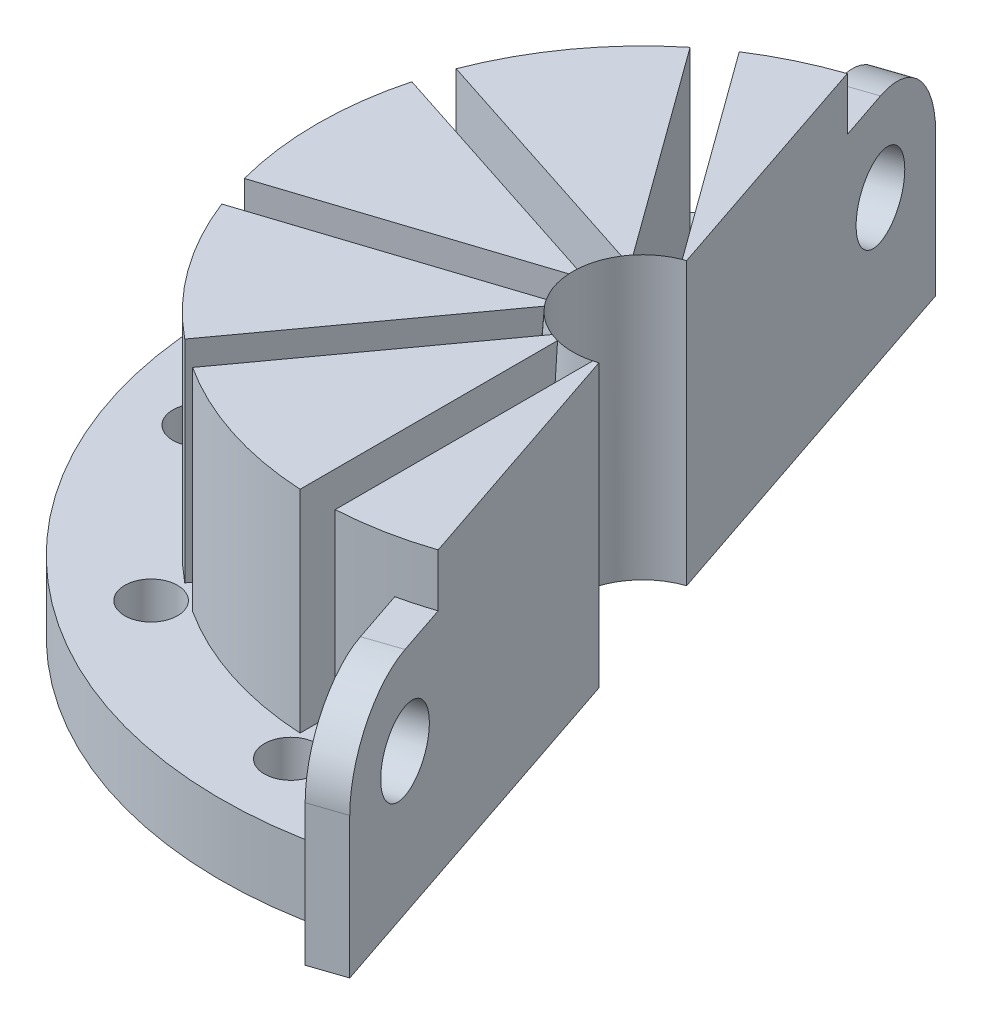
from build123d import *
from build123d.topology import SkipClean

# Parameters (mm, degrees)
SKETCH1_R           = 11.984375
SKETCH1_R_2         = 1.984375
SKETCH1_R_3         = 0.75
BOSS_EXTRUDE1_DEPTH = 2
SKETCH6_W           = 23.96875
SKETCH6_H           = 8
CUT_EXTRUDE1_DEPTH  = 19.741677841
BOSS_EXTRUDE3_START = -2
SKETCH7_R           = 1.65
BOSS_EXTRUDE3_DEPTH = 2
SKETCH8_R           = 1.1
BOSS_EXTRUDE4_DEPTH = 1
CUT_EXTRUDE2_DEPTH  = 23.122053344


with BuildPart() as part:
    # Sketch1 → Boss-Extrude1 (new body)
    with BuildSketch(Plane(origin=(0, 0, 0), x_dir=(1, 0, 0), z_dir=(0, 1, 0))):
        with Locations(Location((0, 0, 0), (0, 0, 270))):
            Circle(SKETCH1_R)
        with Locations(Location((0, 0, 0), (0, 0, 270))):
            Circle(SKETCH1_R_2, mode=Mode.SUBTRACT)
        with Locations(Location((0, 10, 0), (0, 0, 270))):
            Circle(SKETCH1_R_3, mode=Mode.SUBTRACT)
        with Locations(Location((5.877852523, 8.090169944, 0), (0, 0, 270))):
            Circle(SKETCH1_R_3, mode=Mode.SUBTRACT)
        with Locations(Location((9.510565163, 3.090169944, 0), (0, 0, 270))):
            Circle(SKETCH1_R_3, mode=Mode.SUBTRACT)
        with Locations(Location((9.510565163, -3.090169944, 0), (0, 0, 270))):
            Circle(SKETCH1_R_3, mode=Mode.SUBTRACT)
        with Locations(Location((5.877852523, -8.090169944, 0), (0, 0, 270))):
            Circle(SKETCH1_R_3, mode=Mode.SUBTRACT)
        with Locations(Location((0, -10, 0), (0, 0, 270))):
            Circle(SKETCH1_R_3, mode=Mode.SUBTRACT)
        with Locations(Location((-5.877852523, -8.090169944, 0), (0, 0, 270))):
            Circle(SKETCH1_R_3, mode=Mode.SUBTRACT)
        with Locations(Location((-9.510565163, -3.090169944, 0), (0, 0, 270))):
            Circle(SKETCH1_R_3, mode=Mode.SUBTRACT)
        with Locations(Location((-9.510565163, 3.090169944, 0), (0, 0, 270))):
            Circle(SKETCH1_R_3, mode=Mode.SUBTRACT)
        with Locations(Location((-5.877852523, 8.090169944, 0), (0, 0, 270))):
            Circle(SKETCH1_R_3, mode=Mode.SUBTRACT)
    extrude(amount=BOSS_EXTRUDE1_DEPTH)

    # Sweep1: sweep along a path in Sketch3
    with SkipClean():  # the faces are left unmerged after this step: merging them gives an invalid solid
        with BuildLine(Plane(origin=(0, 0, 0), x_dir=(0, 0, -1), z_dir=(1, 0, 0))) as sweep1_path:
            Line((0, 2), (0, 8))
        # Sketch2 → Sweep1 (sweep)
        with BuildSketch(Plane(origin=(0, 2, 0), x_dir=(1, 0, 0), z_dir=(0, 1, 0))):
            with BuildLine():
                Line((-0.5, 9.236476601), (-0.5, 1.920350005))
                ThreePointArc((-0.5, 1.920350005), (-0.613205598, 1.887252775), (-0.724244915, 1.847488415))
                Line((-0.724244915, 1.847488415), (-5.024556232, 7.766359164))
                ThreePointArc((-5.024556232, 7.766359164), (-2.858407198, 8.797272776), (-0.5, 9.236476601))
            make_face()
            with BuildLine():
                Line((0.5, 9.236476601), (0.5, 1.920350005))
                ThreePointArc((0.5, 1.920350005), (0.613205598, 1.887252775), (0.724244915, 1.847488415))
                Line((0.724244915, 1.847488415), (5.024556232, 7.766359164))
                ThreePointArc((5.024556232, 7.766359164), (2.858407198, 8.797272776), (0.5, 9.236476601))
            make_face()
            with BuildLine():
                Line((5.833573226, 7.178573912), (1.533261909, 1.259703163))
                ThreePointArc((1.533261909, 1.259703163), (1.605393098, 1.16638636), (1.671852888, 1.068949045))
                Line((1.671852888, 1.068949045), (8.629902762, 3.329756496))
                ThreePointArc((8.629902762, 3.329756496), (7.483407198, 5.437013584), (5.833573226, 7.178573912))
            make_face()
            with BuildLine():
                Line((8.938919756, 2.37869998), (1.980869883, 0.117892528))
                ThreePointArc((1.980869883, 0.117892528), (1.984375, 0), (1.980869883, -0.117892528))
                Line((1.980869883, -0.117892528), (8.938919756, -2.37869998))
                ThreePointArc((8.938919756, -2.37869998), (9.25, 0), (8.938919756, 2.37869998))
            make_face()
            with BuildLine():
                Line((8.629902762, -3.329756496), (1.671852888, -1.068949045))
                ThreePointArc((1.671852888, -1.068949045), (1.605393098, -1.16638636), (1.533261909, -1.259703163))
                Line((1.533261909, -1.259703163), (5.833573226, -7.178573912))
                ThreePointArc((5.833573226, -7.178573912), (7.483407198, -5.437013584), (8.629902762, -3.329756496))
            make_face()
            with BuildLine():
                Line((5.024556232, -7.766359164), (0.724244915, -1.847488415))
                ThreePointArc((0.724244915, -1.847488415), (0.613205598, -1.887252775), (0.5, -1.920350005))
                Line((0.5, -1.920350005), (0.5, -9.236476601))
                ThreePointArc((0.5, -9.236476601), (2.858407198, -8.797272776), (5.024556232, -7.766359164))
            make_face()
            with BuildLine():
                Line((-0.5, -9.236476601), (-0.5, -1.920350005))
                ThreePointArc((-0.5, -1.920350005), (-0.613205598, -1.887252775), (-0.724244915, -1.847488415))
                Line((-0.724244915, -1.847488415), (-5.024556232, -7.766359164))
                ThreePointArc((-5.024556232, -7.766359164), (-2.858407198, -8.797272776), (-0.5, -9.236476601))
            make_face()
            with BuildLine():
                Line((-5.833573226, -7.178573912), (-1.533261909, -1.259703163))
                ThreePointArc((-1.533261909, -1.259703163), (-1.605393098, -1.16638636), (-1.671852888, -1.068949045))
                Line((-1.671852888, -1.068949045), (-8.629902762, -3.329756496))
                ThreePointArc((-8.629902762, -3.329756496), (-7.483407198, -5.437013584), (-5.833573226, -7.178573912))
            make_face()
            with BuildLine():
                Line((-8.938919756, -2.37869998), (-1.980869883, -0.117892528))
                ThreePointArc((-1.980869883, -0.117892528), (-1.984375, 0), (-1.980869883, 0.117892528))
                Line((-1.980869883, 0.117892528), (-8.938919756, 2.37869998))
                ThreePointArc((-8.938919756, 2.37869998), (-9.25, 0), (-8.938919756, -2.37869998))
            make_face()
            with BuildLine():
                Line((-8.629902762, 3.329756496), (-1.671852888, 1.068949045))
                ThreePointArc((-1.671852888, 1.068949045), (-1.605393098, 1.16638636), (-1.533261909, 1.259703163))
                Line((-1.533261909, 1.259703163), (-5.833573226, 7.178573912))
                ThreePointArc((-5.833573226, 7.178573912), (-7.483407198, 5.437013584), (-8.629902762, 3.329756496))
            make_face()
        sweep(path=sweep1_path.line)

    # Sketch4 → Revolve1 (revolve)
    with SkipClean():  # the faces are left unmerged after this step: merging them gives an invalid solid
        with BuildSketch(Plane(origin=(0, 0, 0), x_dir=(0, 0, -1), z_dir=(1, 0, 0)), mode=Mode.PRIVATE) as revolve1_sk:
            Polygon((-2.37869998, 2), (-1.984375, 2), (-1.984375, 8), align=None)
        revolve(revolve1_sk.sketch.rotate(Axis((0, 0, 0), (0, 1, 0)), 165.405971265), axis=Axis((0, 0, 0), (0, 1, 0)))

    # Sketch6 → Cut-Extrude1 (cut, through all)
    with SkipClean():  # the faces are left unmerged after this step: merging them gives an invalid solid
        with BuildSketch(Plane(origin=(0, 0, 0), x_dir=(-0.3193728209047868, 0, -0.9476291475399641), z_dir=(-0.9476291475399641, 0, 0.3193728209047868))):
            with Locations((0, -4)):
                Rectangle(SKETCH6_W, SKETCH6_H)
        extrude(amount=-CUT_EXTRUDE1_DEPTH, mode=Mode.SUBTRACT)

    # Sketch7 → Boss-Extrude3 (add)
    with SkipClean():  # the faces are left unmerged after this step: merging them gives an invalid solid
        with BuildSketch(Plane(origin=(0, 2, 0), x_dir=(1, 0, 0), z_dir=(0, 1, 0)).offset(BOSS_EXTRUDE3_START)):
            with BuildLine():
                Line((-9.021857716, -7.888683508), (-1.576209535, -16.403865848))
                ThreePointArc((-1.576209535, -16.403865848), (2.803074288, -17.134270389), (4.375298385, -12.982195127))
                Line((4.375298385, -12.982195127), (3.827483651, -11.356743065))
                ThreePointArc((3.827483651, -11.356743065), (-3.122857627, -11.570350227), (-9.021857716, -7.888683508))
            make_face()
            with Locations(Location((1.058596369, -14.1, 0), (0, 0, 270))):
                Circle(SKETCH7_R, mode=Mode.SUBTRACT)
        extrude(amount=BOSS_EXTRUDE3_DEPTH)

    # Sketch8 → Boss-Extrude4 (add)
    # profile 1 of 2: a face of its own
    with SkipClean():  # the faces are left unmerged after this step: merging them gives an invalid solid
        with BuildSketch(Plane(origin=(0, 0, 0), x_dir=(-0.31937282090478675, 0, -0.9476291475399641), z_dir=(0.9476291475399641, 0, -0.31937282090478675))):
            with BuildLine():
                Line((-13.25, 4), (-13.25, 2))
                Line((-13.25, 2), (-8.75, 2))
                Line((-8.75, 2), (-8.75, 6.5))
                Line((-8.75, 6.5), (-9.25, 6.5))
                Line((-9.25, 6.5), (-10.75, 6.5))
                ThreePointArc((-10.75, 6.5), (-12.517766953, 5.767766953), (-13.25, 4))
            make_face()
            with Locations((-10.75, 4)):
                Circle(SKETCH8_R, mode=Mode.SUBTRACT)
        # profile 2 of 2: a face of its own
        with BuildSketch(Plane(origin=(0, 0, 0), x_dir=(-0.31937282090478675, 0, -0.9476291475399641), z_dir=(0.9476291475399641, 0, -0.31937282090478675))):
            with BuildLine():
                Line((11.484375, 2), (8.75, 2))
                Line((8.75, 2), (8.75, 6.5))
                Line((8.75, 6.5), (9.25, 6.5))
                Line((9.25, 6.5), (10.75, 6.5))
                ThreePointArc((10.75, 6.5), (12.517766953, 5.767766953), (13.25, 4))
                Line((13.25, 4), (13.25, 2))
                Line((13.25, 2), (13.25, 0))
                Line((13.25, 0), (11.984375, 0))
                Line((11.984375, 0), (11.484375, 0))
                Line((11.484375, 0), (11.484375, 2))
            make_face()
            with Locations((10.75, 4)):
                Circle(SKETCH8_R, mode=Mode.SUBTRACT)
        extrude(amount=-BOSS_EXTRUDE4_DEPTH)

    # Sketch9 → Cut-Extrude2 (cut, through all)
    with SkipClean():  # the faces are left unmerged after this step: merging them gives an invalid solid
        with BuildSketch(Plane(origin=(0, 2, 0), x_dir=(1, 0, 0), z_dir=(0, 1, 0))):
            with BuildLine():
                Line((-9.021857716, -7.888683508), (-1.576209535, -16.403865848))
                ThreePointArc((-1.576209535, -16.403865848), (2.803074288, -17.134270389), (4.375298385, -12.982195127))
                Line((4.375298385, -12.982195127), (4.231689877, -12.556086205))
                Line((4.231689877, -12.556086205), (3.284060729, -12.875459026))
                Line((3.284060729, -12.875459026), (2.866506678, -11.6365108))
                ThreePointArc((2.866506678, -11.6365108), (-3.603281692, -11.429855869), (-9.021857716, -7.888683508))
            make_face()
        extrude(amount=-CUT_EXTRUDE2_DEPTH, mode=Mode.SUBTRACT)


solid = part.part
